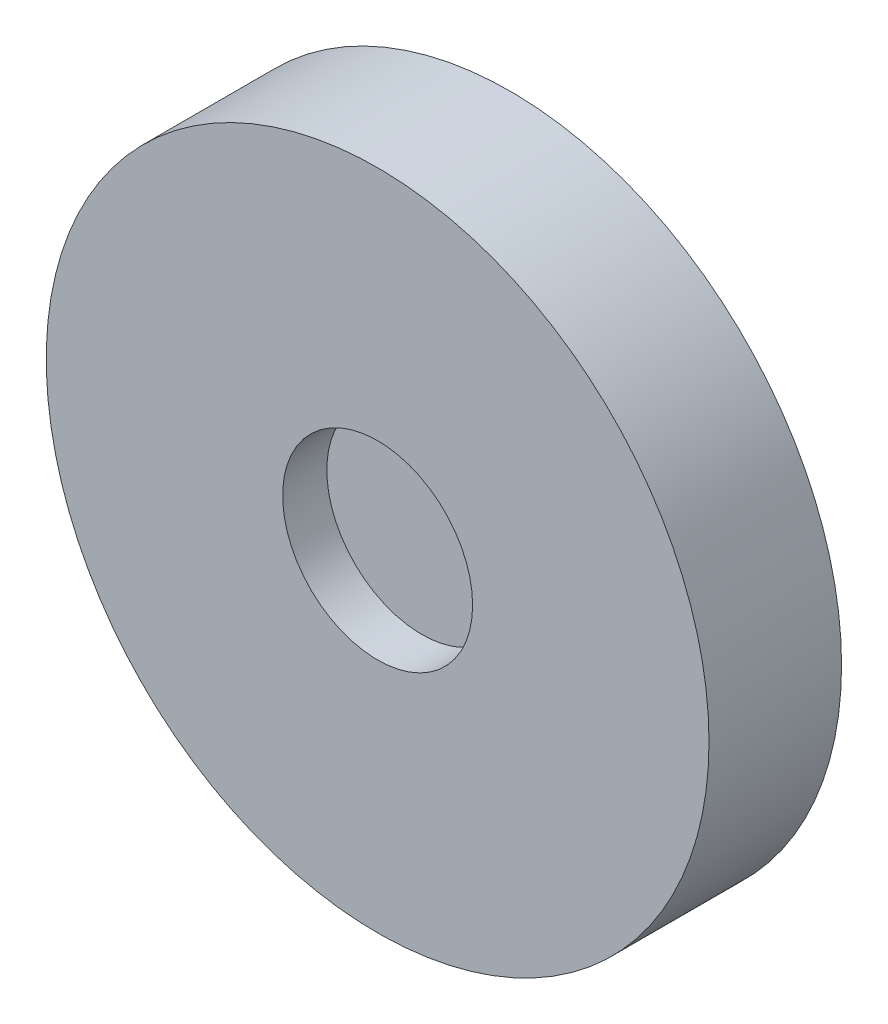
from build123d import *

# Parameters (mm, degrees)
SKETCH1_R           = 7.5
BOSS_EXTRUDE1_DEPTH = 3
SKETCH2_R           = 2.15
CUT_EXTRUDE1_DEPTH  = 1


with BuildPart() as part:
    # Sketch1 → Boss-Extrude1 (new body)
    with BuildSketch(Plane.XY):
        Circle(SKETCH1_R)
    extrude(amount=BOSS_EXTRUDE1_DEPTH)

    # Sketch2 → Cut-Extrude1 (cut)
    with BuildSketch(Plane.XY.offset(3)):
        Circle(SKETCH2_R)
    extrude(amount=-CUT_EXTRUDE1_DEPTH, mode=Mode.SUBTRACT)


solid = part.part
